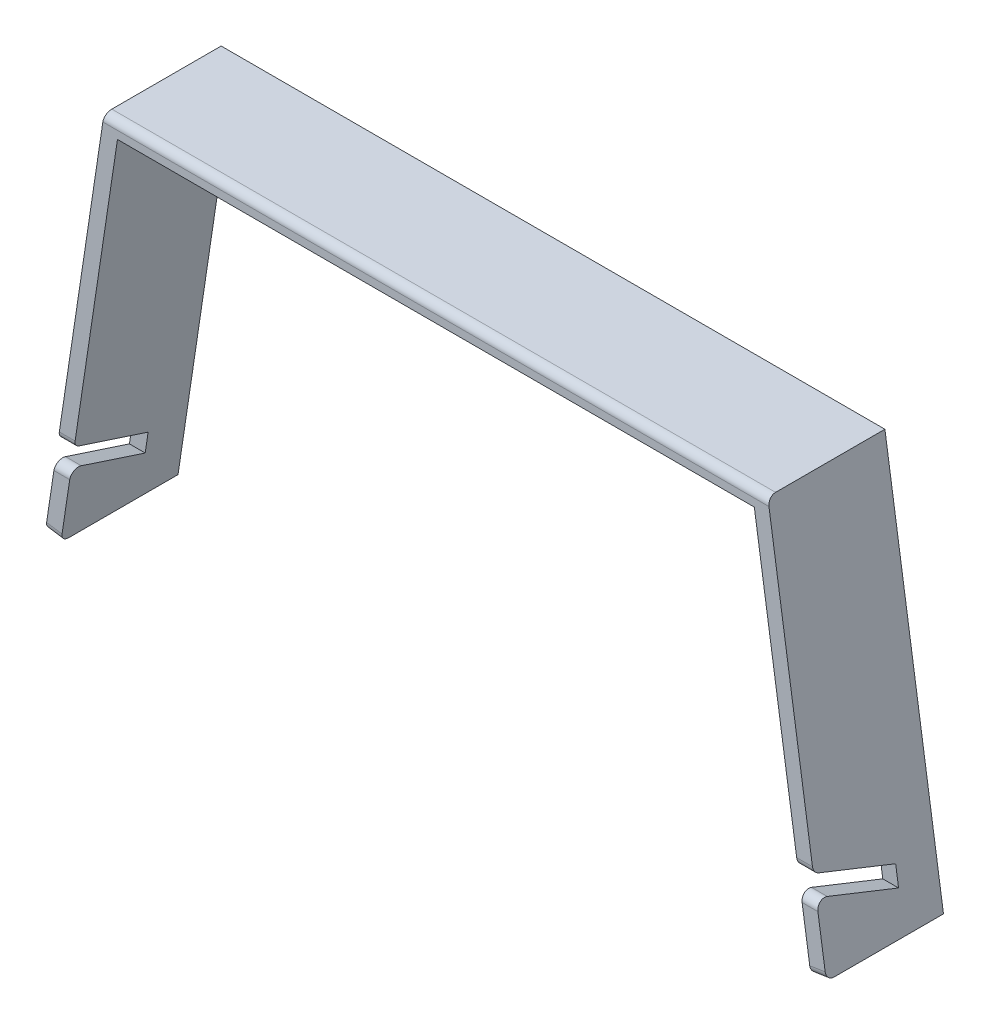
from build123d import *

# Parameters (mm, degrees)
LINEAR_AUSTRAGEN_D_NN1_DEPTH         = 15
VERRUNDUNG1_R                        = 1
SCHNITT_LINEAR_AUSTRAGEN2_DEPTH      = 73.284161474
SCHNITT_LINEAR_AUSTRAGEN2_DEPTH_BACK = 73.284161474
VERRUNDUNG2_R                        = 1


with BuildPart() as part:
    # Skizze1 → Linear-Austragen-Dünn1 (new body)
    with BuildSketch(Plane.XY):
        Polygon((-50, 0), (-42.5, 50), (42.5, 50), (50, 0), (48.022127294, -0.296680906), (40.777625158, 48), (-40.777625158, 48), (-48.022127294, -0.296680906), align=None)
    extrude(amount=LINEAR_AUSTRAGEN_D_NN1_DEPTH)

    # Verrundung1
    verrundung1_edges = [part.edges().sort_by_distance(p)[0] for p in [
        (0, 50, 15),
        (-49.011063647, -0.148340453, 15),
        (49.011063647, -0.148340453, 15),
    ]]
    fillet(verrundung1_edges, radius=VERRUNDUNG1_R)

    # Skizze2 → Schnitt-Linear austragen2 (cut, two sides: drawn at the far end of the back side and taken through both)
    with BuildSketch(Plane(origin=(0, 0, 0), x_dir=(0, 0, -1), z_dir=(1, 0, 0)).offset(-SCHNITT_LINEAR_AUSTRAGEN2_DEPTH_BACK)):
        Polygon((-15, 11.139702343), (-5, 7.5), (-5, 5), (-15, 8.639702343), align=None)
    extrude(amount=SCHNITT_LINEAR_AUSTRAGEN2_DEPTH + SCHNITT_LINEAR_AUSTRAGEN2_DEPTH_BACK, mode=Mode.SUBTRACT)

    # Verrundung2
    verrundung2_edges = [part.edges().sort_by_distance(p)[0] for p in [
        (-47.692857228, 8.639702343, 15),
        (47.692857228, 8.639702343, 15),
        (47.317857228, 11.139702343, 15),
        (-47.317857228, 11.139702343, 15),
    ]]
    fillet(verrundung2_edges, radius=VERRUNDUNG2_R)


solid = part.part
